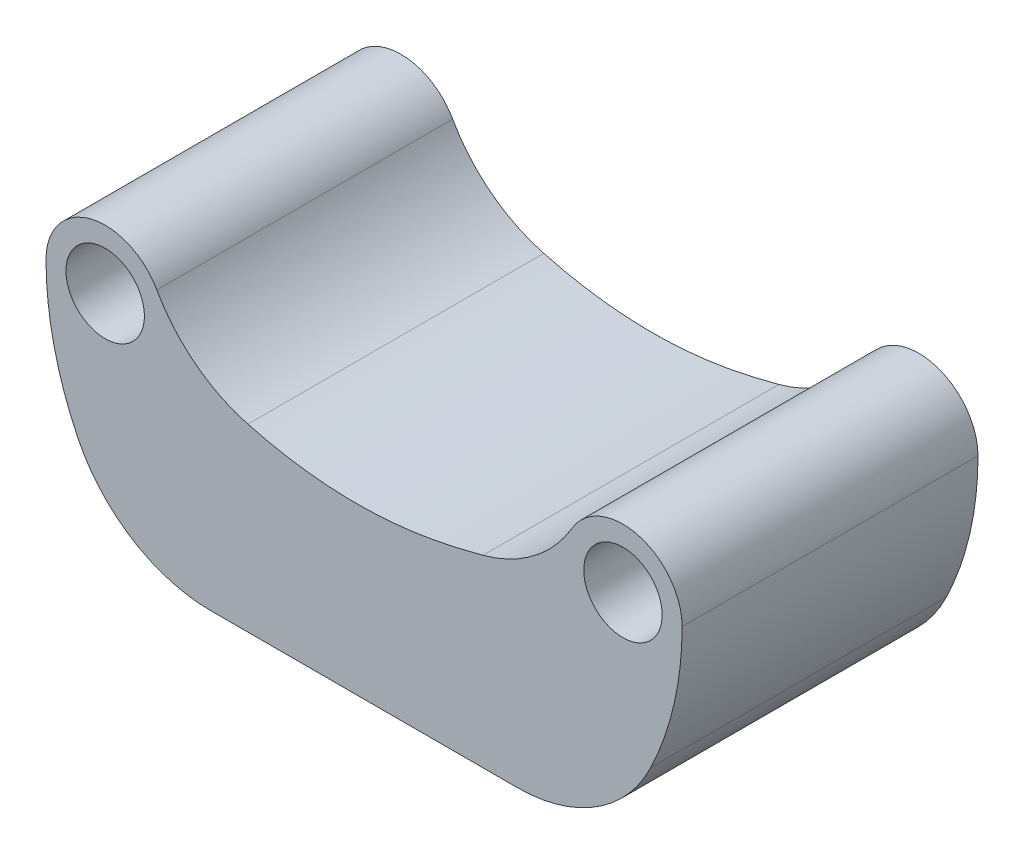
from build123d import *

# Parameters (mm, degrees)
SCHIZZO1_R                   = 2.65
ESTRUSIONE_ESTRUSIONE1_DEPTH = 20
RACCORDO1_R                  = 10


with BuildPart() as part:
    # Schizzo1 → Estrusione-Estrusione1 (new body)
    with BuildSketch(Plane.XY):
        with BuildLine():
            Line((-15.402921801, -15), (15.402921801, -15))
            ThreePointArc((15.402921801, -15), (19.917490037, -8.095899619), (21.5, 0))
            ThreePointArc((21.5, 0), (18.550983955, 3.85946016), (14.052283637, 2.028115352))
            ThreePointArc((14.052283637, 2.028115352), (11.496390023, -0.853653439), (8.040859025, -2.555560913))
            add(Edge.make_bspline(
                [(-7.852499182, -2.82564864), (-5.063118639, -3.566960484), (0.144262576, -4.132980744), (5.056977543, -3.361609436), (8.040859025, -2.555560913)],
                knots=[0.170124619, 0.170124619, 0.170124619, 0.170124619, 0.505124636, 0.849602566, 0.849602566, 0.849602566, 0.849602566], degree=3))
            ThreePointArc((-7.852499182, -2.82564864), (-11.415971798, -1.060452164), (-14.009724205, 1.953963888))
            ThreePointArc((-14.009724205, 1.953963888), (-18.509677379, 3.870471753), (-21.5, 0))
            ThreePointArc((-21.5, 0), (-19.917490037, -8.095899619), (-15.402921801, -15))
        make_face()
        with Locations(Location((-17.5, 0, 0), (0, 0, 180))):
            Circle(SCHIZZO1_R, mode=Mode.SUBTRACT)
        with Locations(Location((17.5, 0, 0), (0, 0, 180))):
            Circle(SCHIZZO1_R, mode=Mode.SUBTRACT)
    extrude(amount=ESTRUSIONE_ESTRUSIONE1_DEPTH)

    # Raccordo1
    raccordo1_edges = [part.edges().sort_by_distance(p)[0] for p in [
        (15.402921801, -15, 10),
        (-15.402921801, -15, 10),
    ]]
    fillet(raccordo1_edges, radius=RACCORDO1_R)


solid = part.part
